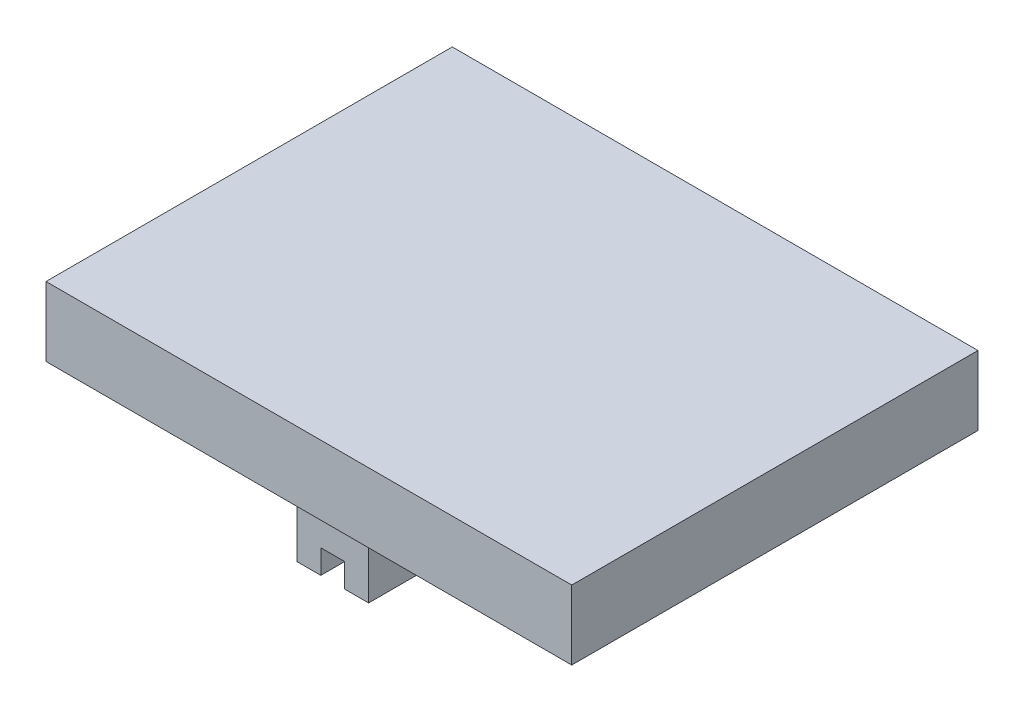
from build123d import *

# Parameters (mm, degrees)
BOSS_EXTRUDE1_DEPTH = 15
SKETCH2_W           = 22
SKETCH2_H           = 17
BOSS_EXTRUDE2_DEPTH = 2.9


with BuildPart() as part:
    # Sketch1 → Boss-Extrude1 (new body)
    with BuildSketch(Plane.XY):
        Polygon((0, 0), (1, 0), (1, 1), (2, 1), (2, 0), (3, 0), (3, 3), (0, 3), align=None)
    extrude(amount=BOSS_EXTRUDE1_DEPTH)

    # Sketch2 → Boss-Extrude2 (add)
    with BuildSketch(Plane(origin=(0, 3, 0), x_dir=(1, 0, 0), z_dir=(0, 1, 0))):
        with Locations((1.5, -7.5)):
            Rectangle(SKETCH2_W, SKETCH2_H)
    extrude(amount=BOSS_EXTRUDE2_DEPTH)


solid = part.part
